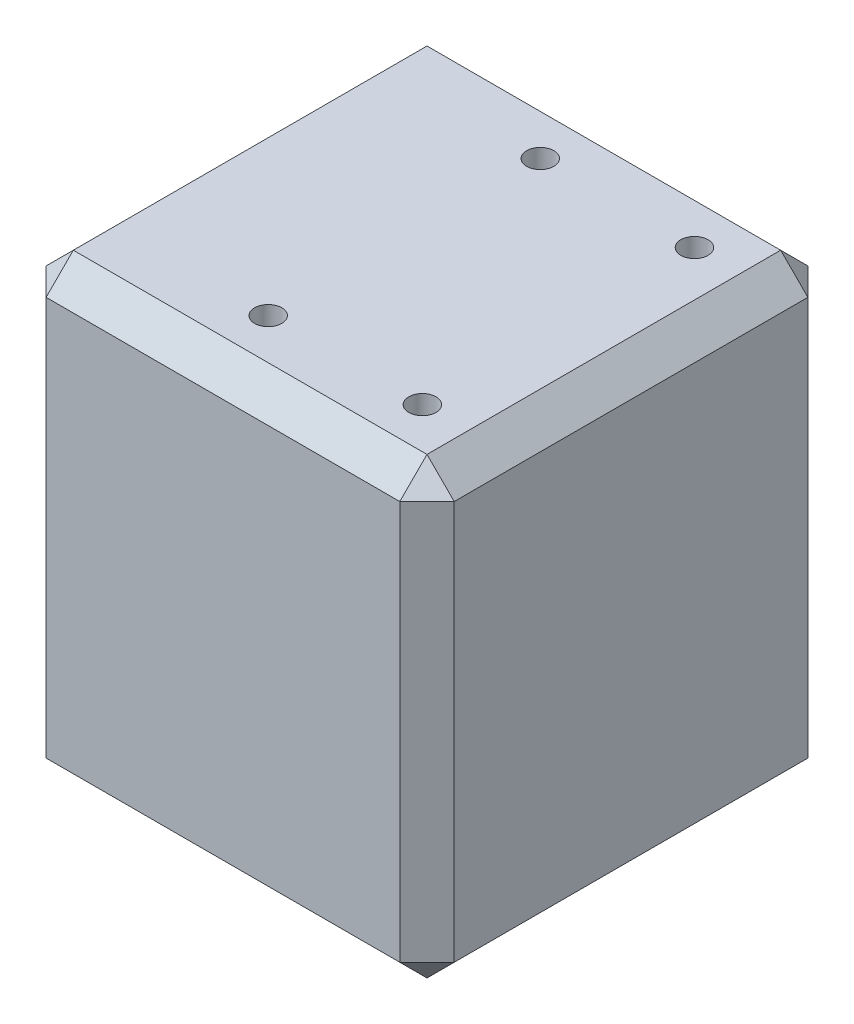
from build123d import *

# Parameters (mm, degrees)
SKETCH1_W           = 45
SKETCH1_H           = 45
BOSS_EXTRUDE1_DEPTH = 50
SKETCH2_R           = 4.15
CUT_EXTRUDE1_DEPTH  = 30
SKETCH3_R           = 4.15
CUT_EXTRUDE2_DEPTH  = 30
CHAMFER1_SIZE       = 3
SKETCH5_R           = 1.5
CUT_EXTRUDE3_DEPTH  = 10


with BuildPart() as part:
    # Sketch1 → Boss-Extrude1 (new body)
    with BuildSketch(Plane(origin=(0, 0, 0), x_dir=(1, 0, 0), z_dir=(0, 1, 0))):
        Rectangle(SKETCH1_W, SKETCH1_H)
    extrude(amount=BOSS_EXTRUDE1_DEPTH)

    # Sketch2 → Cut-Extrude1 (cut)
    with BuildSketch(Plane(origin=(0, 0, -22.5), x_dir=(-1, 0, 0), z_dir=(0, 0, -1))):
        with Locations((0, 12.5)):
            Circle(SKETCH2_R)
    extrude(amount=-CUT_EXTRUDE1_DEPTH, mode=Mode.SUBTRACT)

    # Sketch3 → Cut-Extrude2 (cut)
    with BuildSketch(Plane.ZY.offset(22.5)):
        with Locations((0, 37.5)):
            Circle(SKETCH3_R)
    extrude(amount=-CUT_EXTRUDE2_DEPTH, mode=Mode.SUBTRACT)

    # Chamfer1
    chamfer1_edges = [part.edges().sort_by_distance(p)[0] for p in [
        (-22.5, 50, 0),
        (0, 50, 22.5),
        (22.5, 50, 0),
        (0, 0, 22.5),
        (-22.5, 0, 0),
        (0, 0, -22.5),
        (22.5, 0, 0),
        (22.5, 25, 22.5),
        (-22.5, 25, 22.5),
        (-22.5, 25, -22.5),
        (22.5, 25, -22.5),
        (0, 50, -22.5),
    ]]
    chamfer(chamfer1_edges, length=CHAMFER1_SIZE)

    # Sketch5 → Cut-Extrude3 (cut)
    with BuildSketch(Plane(origin=(0, 50, 0), x_dir=(1, 0, 0), z_dir=(0, 1, 0))):
        with Locations(Location((-2.51, -15, 0), (0, 0, 270))):
            Circle(SKETCH5_R)
        with Locations(Location((14.49, -15, 0), (0, 0, 270))):
            Circle(SKETCH5_R)
        with Locations(Location((14.49, 15, 0), (0, 0, 90))):
            Circle(SKETCH5_R)
        with Locations(Location((-2.51, 15, 0), (0, 0, 90))):
            Circle(SKETCH5_R)
    extrude(amount=-CUT_EXTRUDE3_DEPTH, mode=Mode.SUBTRACT)


solid = part.part
